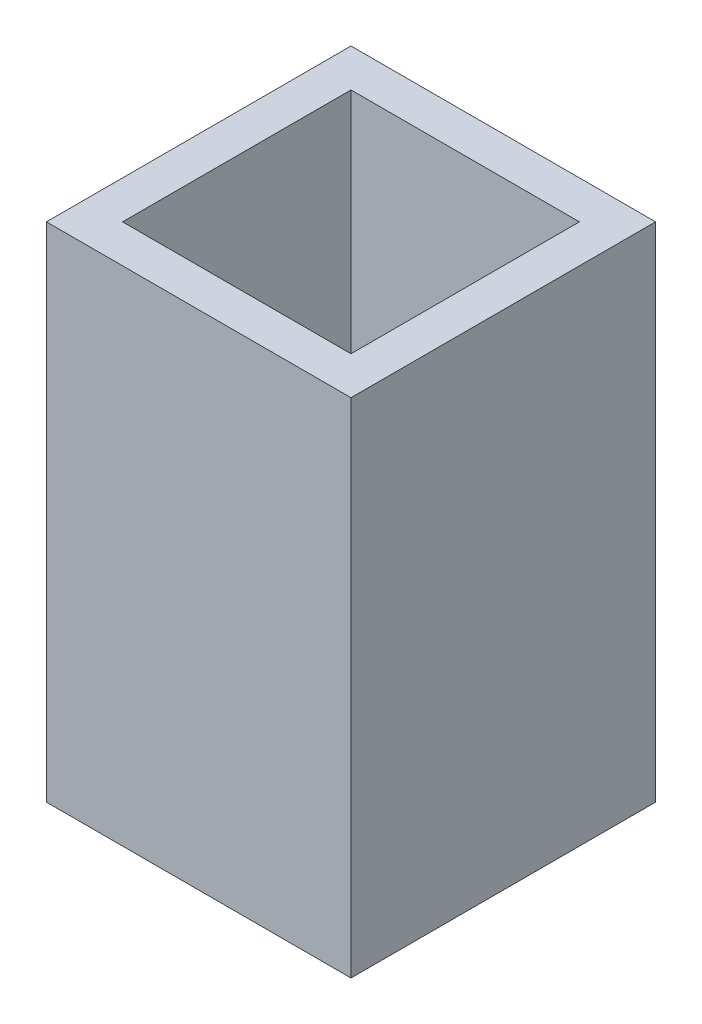
from build123d import *

# Parameters (mm, degrees)
SKETCH1_W           = 25.4
SKETCH1_H           = 25.4
BOSS_EXTRUDE1_DEPTH = 41.91
SKETCH4_W           = 19.05
SKETCH4_H           = 19.05
CUT_EXTRUDE2_DEPTH  = 56.197537083


with BuildPart() as part:
    # Sketch1 → Boss-Extrude1 (new body)
    with BuildSketch(Plane(origin=(0, 0, 0), x_dir=(1, 0, 0), z_dir=(0, 1, 0))):
        with Locations((12.7, 12.7)):
            Rectangle(SKETCH1_W, SKETCH1_H)
    extrude(amount=BOSS_EXTRUDE1_DEPTH)

    # Sketch4 → Cut-Extrude2 (cut, through all)
    with BuildSketch(Plane(origin=(0, 0, 0), x_dir=(-1, 0, 0), z_dir=(0, -1, 0))):
        with Locations((-12.7, 12.7)):
            Rectangle(SKETCH4_W, SKETCH4_H)
    extrude(amount=-CUT_EXTRUDE2_DEPTH, mode=Mode.SUBTRACT)


solid = part.part
